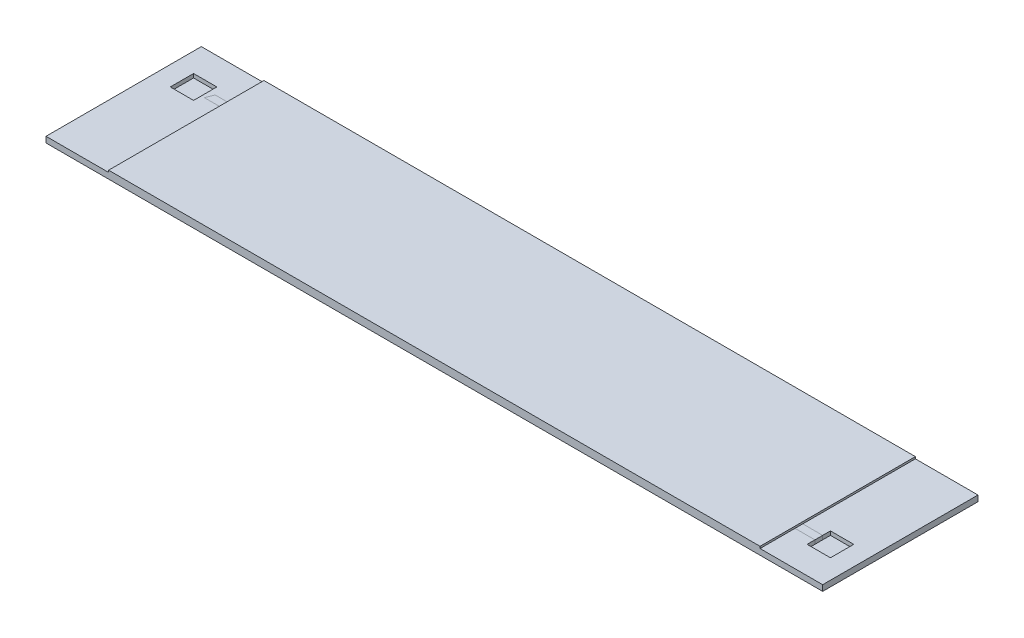
from build123d import *

# Parameters (mm, degrees)
SKETCH1_W           = 100
SKETCH1_H           = 20
BOSS_EXTRUDE1_DEPTH = 0.5
SKETCH2_W           = 1
SKETCH2_H           = 0.5
SKETCH4_W           = 3
SKETCH4_H           = 3
CUT_EXTRUDE1_DEPTH  = 0.75
SKETCH5_W           = 5.5
SKETCH5_H           = 20
CUT_EXTRUDE2_DEPTH  = 0.25
SKETCH6_W           = 2.562318192
SKETCH6_H           = 20
CUT_EXTRUDE3_DEPTH  = 0.25


with BuildPart() as part:
    # Sketch1 → Boss-Extrude1 (new, symmetric)
    with BuildSketch(Plane(origin=(0, 0, 0), x_dir=(1, 0, 0), z_dir=(0, 1, 0))):
        Rectangle(SKETCH1_W, SKETCH1_H)
    extrude(amount=BOSS_EXTRUDE1_DEPTH, both=True)


with BuildPart() as body_2:
    # Sweep2: sweep along a curve in space
    with BuildLine() as sweep2_path:
        Line((40, 0, 5), (46, 0, 5))
        Line((-40, 0, 5), (40, 0, 5))
        Line((-40, 0, 0), (-40, 0, 5))
        Line((40, 0, 0), (-40, 0, 0))
        Line((40, 0, -5), (40, 0, 0))
        Line((-40, 0, -5), (40, 0, -5))
        Line((-40, 0, -5), (-46, 0, -5))
    # Sketch2 → Sweep2 (sweep)
    with BuildSketch(Plane(origin=(40, 0, 0), x_dir=(0, 0, -1), z_dir=(1, 0, 0))):
        with Locations((-5, 0)):
            Rectangle(SKETCH2_W, SKETCH2_H)
    sweep(path=sweep2_path.line, transition=Transition.RIGHT)


with BuildPart() as cut_extrude1_tool:
    # Sketch4 → Cut-Extrude1 (new body)
    with BuildSketch(Plane(origin=(0, 0.5, 0), x_dir=(1, 0, 0), z_dir=(0, 1, 0))):
        with Locations((-46, 5)):
            Rectangle(SKETCH4_W, SKETCH4_H)
        with Locations((46, -5)):
            Rectangle(SKETCH4_W, SKETCH4_H)
    extrude(amount=-CUT_EXTRUDE1_DEPTH)


with BuildPart() as part_1:
    add(part.part)

    # Cut-Extrude1: cut by cut_extrude1_tool
    add(cut_extrude1_tool.part, mode=Mode.SUBTRACT)

    # Sketch5 → Cut-Extrude2 (cut)
    with BuildSketch(Plane(origin=(0, 0.5, 0), x_dir=(1, 0, 0), z_dir=(0, 1, 0))):
        with Locations((47.25, 0)):
            Rectangle(SKETCH5_W, SKETCH5_H)
        with Locations((-47.25, 0)):
            Rectangle(SKETCH5_W, SKETCH5_H)
    extrude(amount=-CUT_EXTRUDE2_DEPTH, mode=Mode.SUBTRACT)

    # Sketch6 → Cut-Extrude3 (cut)
    with BuildSketch(Plane(origin=(0, 0.5, 0), x_dir=(1, 0, 0), z_dir=(0, 1, 0))):
        with Locations((-43.218840904, 0)):
            Rectangle(SKETCH6_W, SKETCH6_H)
        with Locations((43.218840904, 0)):
            Rectangle(SKETCH6_W, SKETCH6_H)
    extrude(amount=-CUT_EXTRUDE3_DEPTH, mode=Mode.SUBTRACT)


with BuildPart() as body_2_1:
    add(body_2.part)

    # Cut-Extrude1: cut by cut_extrude1_tool
    add(cut_extrude1_tool.part, mode=Mode.SUBTRACT)


solid = Compound([part_1.part, body_2_1.part])
